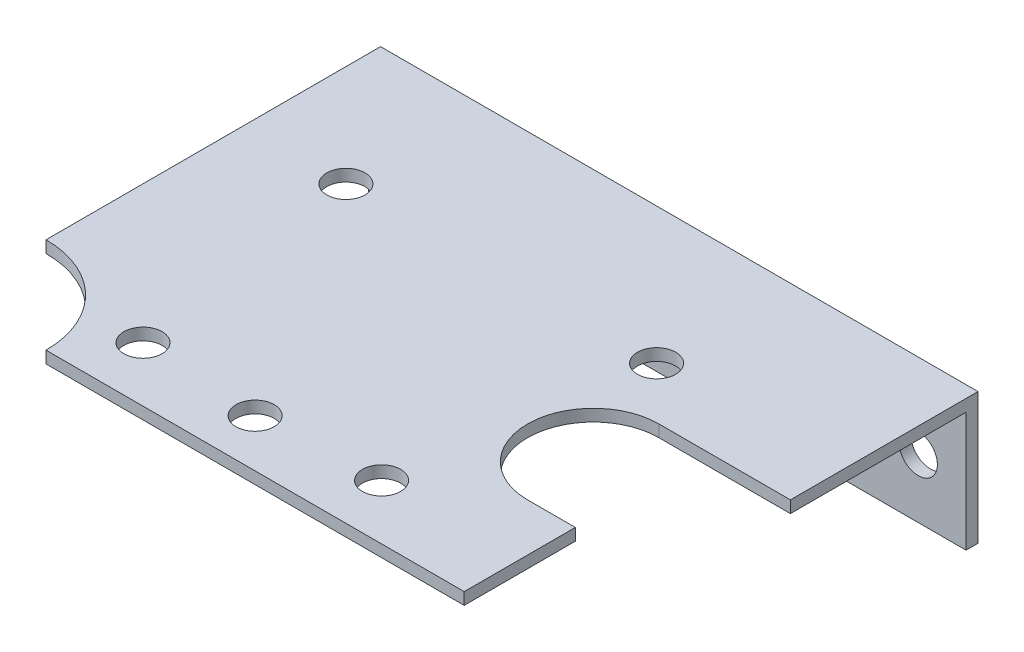
from build123d import *

# Parameters (mm, degrees)
SKETCH_1_R          = 1.6
EXTRUDE_1_DEPTH     = 1
SKETCH_2_W          = 50
SKETCH_2_H          = 1
EXTRUDE_2_DEPTH     = 11
SKETCH_3_R          = 1.6
CUT_EXTRUDE_1_DEPTH = 10


with BuildPart() as part:
    # 草图1 → 凸台-拉伸1 (new body)
    with BuildSketch(Plane(origin=(0, 0, 0), x_dir=(1, 0, 0), z_dir=(0, 1, 0))):
        with BuildLine():
            Line((8, 0), (43, 0))
            Line((43, 0), (43, 9.3))
            Line((43, 9.3), (39, 9.3))
            ThreePointArc((39, 9.3), (33.5, 14.8), (39, 20.3))
            Line((39, 20.3), (50, 20.3))
            Line((50, 20.3), (50, 36))
            Line((50, 36), (0, 36))
            Line((0, 36), (0, 8))
            ThreePointArc((0, 8), (5.656854249, 5.656854249), (8, 0))
        make_face()
        with Locations(Location((8.5, 24.6, 0), (0, 0, 270))):
            Circle(SKETCH_1_R, mode=Mode.SUBTRACT)
        with Locations(Location((21.5, 4, 0), (0, 0, 270))):
            Circle(SKETCH_1_R, mode=Mode.SUBTRACT)
        with Locations(Location((34.5, 24.6, 0), (0, 0, 90))):
            Circle(SKETCH_1_R, mode=Mode.SUBTRACT)
        with Locations(Location((31.481983771, 4.6, 0), (0, 0, 270))):
            Circle(SKETCH_1_R, mode=Mode.SUBTRACT)
        with Locations(Location((11.518016229, 4.6, 0), (0, 0, 90))):
            Circle(SKETCH_1_R, mode=Mode.SUBTRACT)
    extrude(amount=EXTRUDE_1_DEPTH)

    # 草图2 → 凸台-拉伸2 (add)
    with BuildSketch(Plane(origin=(0, 1, 0), x_dir=(1, 0, 0), z_dir=(0, 1, 0))):
        with Locations((25, 35.5)):
            Rectangle(SKETCH_2_W, SKETCH_2_H)
    extrude(amount=-EXTRUDE_2_DEPTH)

    # 草图3 → 切除-拉伸1 (cut)
    with BuildSketch(Plane.XY.offset(-35)):
        with Locations((46, -5)):
            Circle(SKETCH_3_R)
        with Locations((18, -5)):
            Circle(SKETCH_3_R)
    extrude(amount=-CUT_EXTRUDE_1_DEPTH, mode=Mode.SUBTRACT)


solid = part.part
